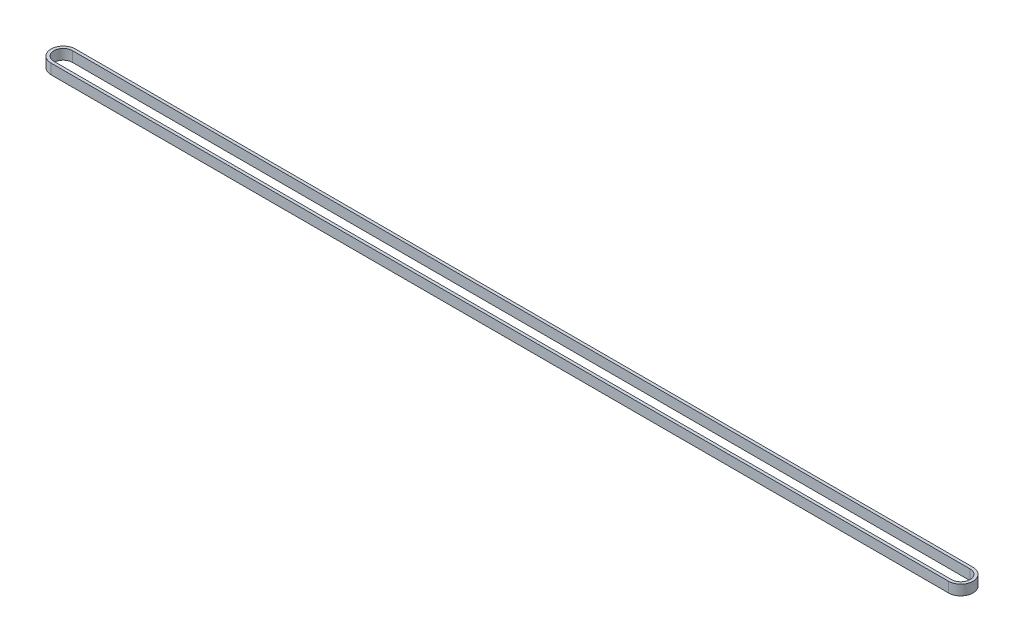
from build123d import *

# Parameters (mm, degrees)
BOSS_EXTRUDE1_DEPTH = 7


with BuildPart() as part:
    # Sketch1 → Boss-Extrude1 (new body)
    with BuildSketch(Plane(origin=(0, 0, 0), x_dir=(1, 0, 0), z_dir=(0, 1, 0))):
        with BuildLine():
            Line((0, 8.37), (616.37, 8.37))
            ThreePointArc((616.37, 8.37), (624.74, 0), (616.37, -8.37))
            Line((616.37, -8.37), (0, -8.37))
            ThreePointArc((0, -8.37), (-8.37, 0), (0, 8.37))
        make_face()
        with BuildLine():
            Line((0, 6.37), (616.37, 6.37))
            ThreePointArc((616.37, 6.37), (622.74, 0), (616.37, -6.37))
            Line((616.37, -6.37), (0, -6.37))
            ThreePointArc((0, -6.37), (-6.37, 0), (0, 6.37))
        make_face(mode=Mode.SUBTRACT)
    extrude(amount=BOSS_EXTRUDE1_DEPTH)


solid = part.part
